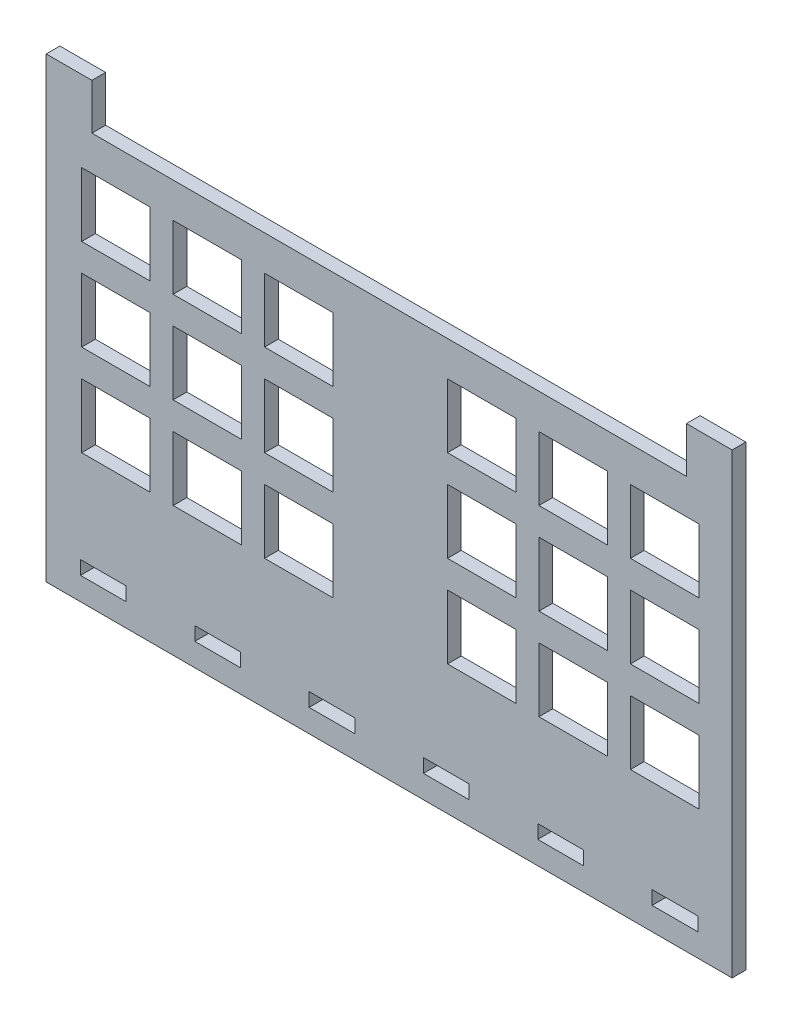
from build123d import *

# Parameters (mm, degrees)
ESQUISSE1_W             = 150
ESQUISSE1_H             = 100
BOSS_EXTRU_1_DEPTH      = 3
ESQUISSE3_W             = 130
ESQUISSE3_H             = 10
ENL_V_MAT_EXTRU_1_DEPTH = 3
ESQUISSE12_W            = 10
ESQUISSE12_H            = 3
ENL_V_MAT_EXTRU_3_DEPTH = 10
ESQUISSE13_W            = 15
ESQUISSE13_H            = 14
ENL_V_MAT_EXTRU_4_DEPTH = 10


with BuildPart() as part:
    # Esquisse1 → Boss.-Extru.1 (new body)
    with BuildSketch(Plane.XY):
        with Locations((75, 50)):
            Rectangle(ESQUISSE1_W, ESQUISSE1_H)
    extrude(amount=BOSS_EXTRU_1_DEPTH)

    # Esquisse3 → Enlèv. mat.-Extru.1 (cut)
    with BuildSketch(Plane.XY.offset(3)):
        with Locations((75, 95)):
            Rectangle(ESQUISSE3_W, ESQUISSE3_H)
    extrude(amount=-ENL_V_MAT_EXTRU_1_DEPTH, mode=Mode.SUBTRACT)

    # Esquisse12 → Enlèv. mat.-Extru.3 (cut)
    with BuildSketch(Plane.XY.offset(3)):
        with Locations((12.5, 6.5)):
            Rectangle(ESQUISSE12_W, ESQUISSE12_H)
        with Locations((37.5, 6.5)):
            Rectangle(ESQUISSE12_W, ESQUISSE12_H)
        with Locations((62.5, 6.5)):
            Rectangle(ESQUISSE12_W, ESQUISSE12_H)
        with Locations((87.5, 6.5)):
            Rectangle(ESQUISSE12_W, ESQUISSE12_H)
        with Locations((112.5, 6.5)):
            Rectangle(ESQUISSE12_W, ESQUISSE12_H)
        with Locations((137.5, 6.5)):
            Rectangle(ESQUISSE12_W, ESQUISSE12_H)
    extrude(amount=-ENL_V_MAT_EXTRU_3_DEPTH, mode=Mode.SUBTRACT)

    # Esquisse13 → Enlèv. mat.-Extru.4 (cut)
    with BuildSketch(Plane.XY.offset(3)):
        with Locations((35.259475166, 75.358514873)):
            Rectangle(ESQUISSE13_W, ESQUISSE13_H)
        with Locations((15.259475166, 75.358514873)):
            Rectangle(ESQUISSE13_W, ESQUISSE13_H)
        with Locations((55.259475166, 75.358514873)):
            Rectangle(ESQUISSE13_W, ESQUISSE13_H)
        with Locations((95.259475166, 75.358514873)):
            Rectangle(ESQUISSE13_W, ESQUISSE13_H)
        with Locations((115.259475166, 75.358514873)):
            Rectangle(ESQUISSE13_W, ESQUISSE13_H)
        with Locations((135.259475166, 75.358514873)):
            Rectangle(ESQUISSE13_W, ESQUISSE13_H)
        with Locations((15.259475166, 55.358514873)):
            Rectangle(ESQUISSE13_W, ESQUISSE13_H)
        with Locations((35.259475166, 55.358514873)):
            Rectangle(ESQUISSE13_W, ESQUISSE13_H)
        with Locations((55.259475166, 55.358514873)):
            Rectangle(ESQUISSE13_W, ESQUISSE13_H)
        with Locations((95.259475166, 55.358514873)):
            Rectangle(ESQUISSE13_W, ESQUISSE13_H)
        with Locations((115.259475166, 55.358514873)):
            Rectangle(ESQUISSE13_W, ESQUISSE13_H)
        with Locations((135.259475166, 55.358514873)):
            Rectangle(ESQUISSE13_W, ESQUISSE13_H)
        with Locations((15.259475166, 35.358514873)):
            Rectangle(ESQUISSE13_W, ESQUISSE13_H)
        with Locations((35.259475166, 35.358514873)):
            Rectangle(ESQUISSE13_W, ESQUISSE13_H)
        with Locations((55.259475166, 35.358514873)):
            Rectangle(ESQUISSE13_W, ESQUISSE13_H)
        with Locations((95.259475166, 35.358514873)):
            Rectangle(ESQUISSE13_W, ESQUISSE13_H)
        with Locations((115.259475166, 35.358514873)):
            Rectangle(ESQUISSE13_W, ESQUISSE13_H)
        with Locations((135.259475166, 35.358514873)):
            Rectangle(ESQUISSE13_W, ESQUISSE13_H)
    extrude(amount=-ENL_V_MAT_EXTRU_4_DEPTH, mode=Mode.SUBTRACT)


solid = part.part
